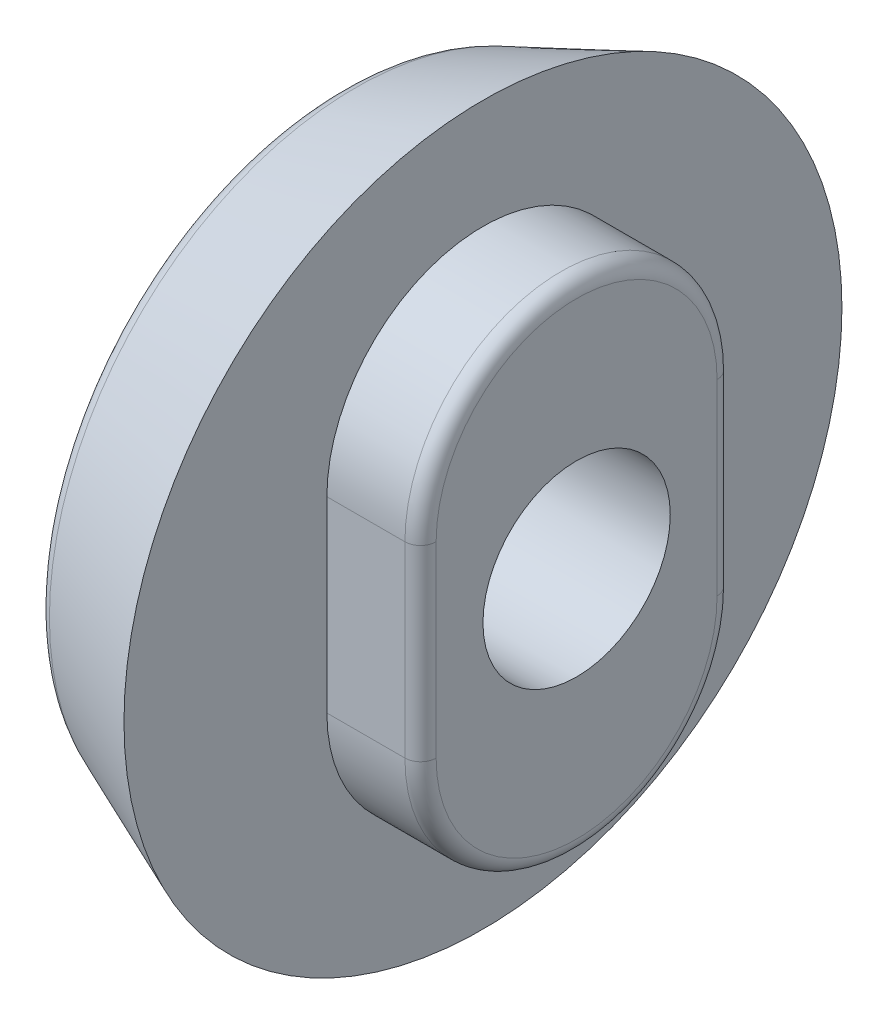
from build123d import *

# Parameters (mm, degrees)
SKETCH_1_W          = 1.7
SKETCH_1_H          = 4.55
FILLET_1_R          = 1
SKETCH_3_R          = 3
EXTRUDE_1_DEPTH     = 3
FILLET_3_R          = 0.5
CUT_EXTRUDE_1_DEPTH = 2


with BuildPart() as part:
    # Эскиз1 → Повернуть1 (revolve)
    with BuildSketch(Plane.XY, mode=Mode.PRIVATE) as revolve_1_sk:
        with Locations((-0.85, 5.275)):
            Rectangle(SKETCH_1_W, SKETCH_1_H)
        Polygon((3, 7.03692641), (3, 3), (0, 3), (0, 7.55), (-1.7, 7.55), (-1.7, 9.55), (3, 11.5), align=None)
    revolve(revolve_1_sk.sketch.rotate(Axis((0, 0, 0), (1, 0, 0)), 90), axis=Axis((0, 0, 0), (1, 0, 0)))

    # Скругление1
    fillet_1_edges = [part.edges().sort_by_distance(p)[0] for p in [
        (-1.7, 0, -9.55),
    ]]
    fillet(fillet_1_edges, radius=FILLET_1_R)

    # Эскиз3 → Бобышка-Вытянуть1 (add)
    with BuildSketch(Plane(origin=(3, 0, 0), x_dir=(0, 0, -1), z_dir=(1, 0, 0))):
        with BuildLine():
            Line((-5, -3), (-5, 3))
            ThreePointArc((-5, 3), (0, 8), (5, 3))
            Line((5, 3), (5, -3))
            ThreePointArc((5, -3), (0, -8), (-5, -3))
        make_face()
        with Locations(Location((0, 0, 0), (0, 0, 180))):
            Circle(SKETCH_3_R, mode=Mode.SUBTRACT)
    extrude(amount=EXTRUDE_1_DEPTH)

    # Скругление3
    fillet_3_edges = [part.edges().sort_by_distance(p)[0] for p in [
        (6, -8, 0),
        (6, 0, -5),
        (6, 8, 0),
        (6, 0, 5),
    ]]
    fillet(fillet_3_edges, radius=FILLET_3_R)

    # Эскиз4 → Вырез-Вытянуть1 (cut)
    with BuildSketch(Plane.ZY.offset(1.7)):
        Polygon((4, 6.92820323), (-4, 6.92820323), (-8, 0), (-4, -6.92820323), (4, -6.92820323), (8, 0), align=None)
    extrude(amount=-CUT_EXTRUDE_1_DEPTH, mode=Mode.SUBTRACT)


solid = part.part
